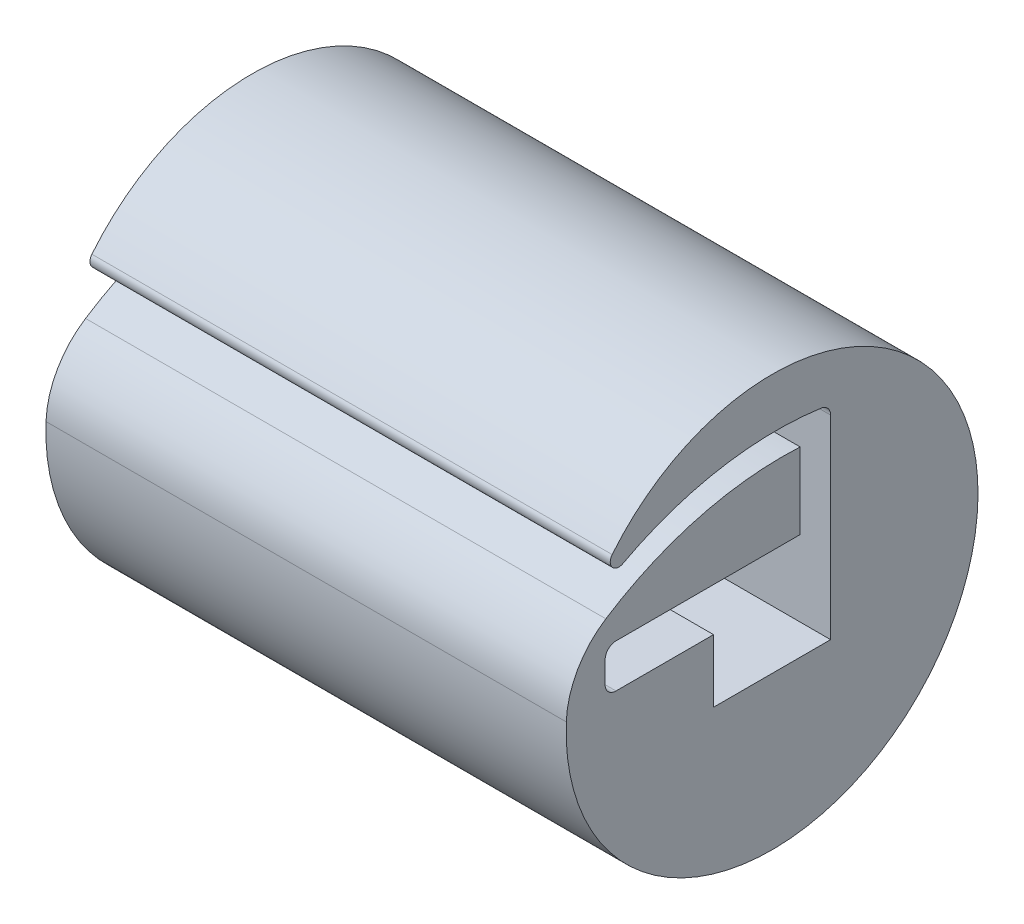
from build123d import *

# Parameters (mm, degrees)
BOSS_EXTRUDE2_DEPTH = 6
FILLET1_R           = 0.25
FILLET2_R           = 2
FILLET3_R           = 0.2


with BuildPart() as part:
    # Sketch1 → Boss-Extrude2 (new, symmetric)
    with BuildSketch(Plane(origin=(0, 0, 0), x_dir=(0, 0, -1), z_dir=(1, 0, 0))):
        with BuildLine():
            Line((-1.35, -1.225), (-1.35, 0.225))
            Line((-1.35, 0.225), (-3.85, 0.225))
            Line((-3.85, 0.225), (-3.85, 1.225))
            Line((-3.85, 1.225), (-1.35, 1.225))
            Line((-1.35, 1.225), (0.648540494, 1.225))
            Line((0.648540494, 1.225), (0.648540494, 2.975))
            ThreePointArc((0.648540494, 2.975), (-2.137325495, 2.599646629), (-4.589321845, 1.225))
            ThreePointArc((-4.589321845, 1.225), (-0.617746402, -4.709659158), (4.75, 0))
            ThreePointArc((4.75, 0), (1.146387884, 4.609587272), (-4.19665045, 2.225))
            ThreePointArc((-4.19665045, 2.225), (-1.546369522, 3.395986963), (1.35, 3.475))
            Line((1.35, 3.475), (1.35, 1.225))
            Line((1.35, 1.225), (1.35, -1.225))
            Line((1.35, -1.225), (-1.35, -1.225))
        make_face()
    extrude(amount=BOSS_EXTRUDE2_DEPTH, both=True)

    # Fillet1
    fillet1_edges = [part.edges().sort_by_distance(p)[0] for p in [
        (0, 1.225, 3.85),
        (0, 0.225, 3.85),
        (0, 3.475, -1.35),
    ]]
    fillet(fillet1_edges, radius=FILLET1_R)

    # Fillet2
    fillet2_edges = [part.edges().sort_by_distance(p)[0] for p in [
        (0, 1.225, 4.589321845),
    ]]
    fillet(fillet2_edges, radius=FILLET2_R)

    # Fillet3
    fillet3_edges = [part.edges().sort_by_distance(p)[0] for p in [
        (0, 2.225, 4.19665045),
    ]]
    fillet(fillet3_edges, radius=FILLET3_R)


solid = part.part
